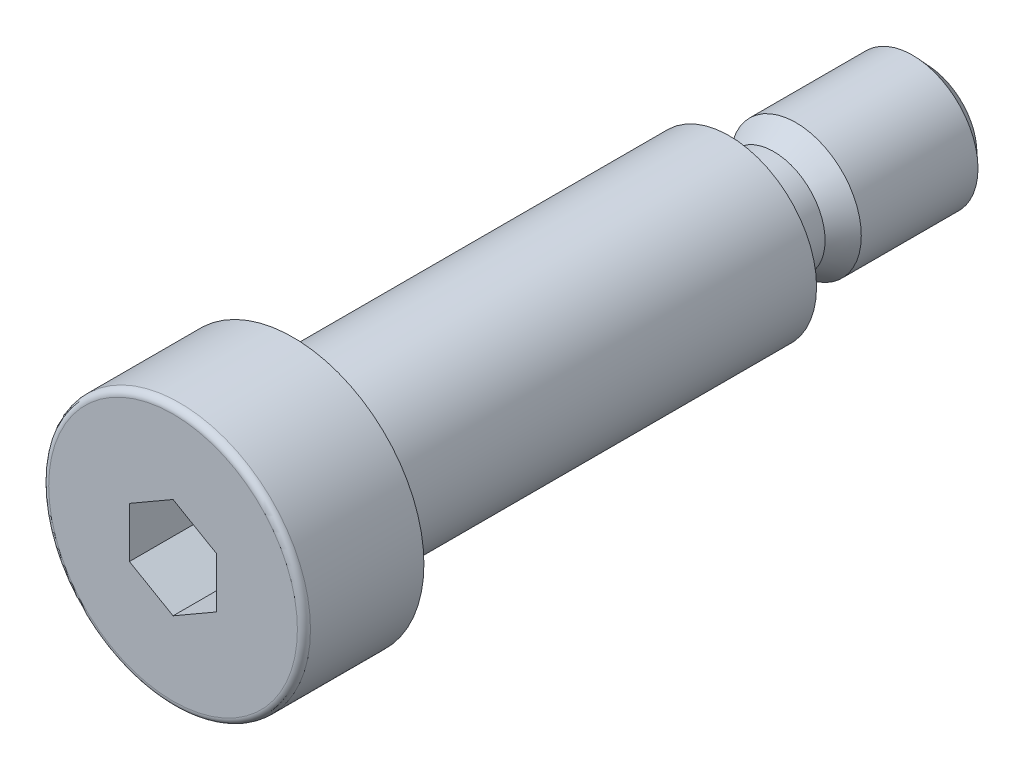
from build123d import *

# Parameters (mm, degrees)
SZKIC1_W                   = 4.7
SZKIC1_H                   = 4.08
WYTNIJ_WYCI_GNI_CIE1_DEPTH = 6.6
ZAOKR_GLENIE1_R            = 0.6


with BuildPart() as part:
    # Szkic1 → Obrót1 (revolve)
    with BuildSketch(Plane(origin=(0, 0, 0), x_dir=(1, 0, 0), z_dir=(0, 1, 0)), mode=Mode.PRIVATE) as obr_t1_sk:
        Polygon((0, -31), (0, -20), (-8, -20), (-12, -20), (-12, -31), align=None)
        Polygon((0, -20), (0, 20), (-4.7, 20), (-8, 20), (-8, -20), align=None)
        with Locations((-2.35, 22.04)):
            Rectangle(SZKIC1_W, SZKIC1_H)
        Polygon((-4.7, 24.08), (0, 24.08), (0, 38), (-4.7, 38), (-6, 36.8), (-6, 26.1), align=None)
    revolve(obr_t1_sk.sketch.rotate(Axis((0, 0, 31), (0, 0, -1)), 180), axis=Axis((0, 0, 31), (0, 0, -1)))

    # Szkic2 → Wytnij-wyciągnięcie1 (cut)
    with BuildSketch(Plane.XY.offset(31)):
        Polygon((4, 2.309401077), (0, 4.618802154), (-4, 2.309401077), (-4, -2.309401077), (0, -4.618802154), (4, -2.309401077), align=None)
    extrude(amount=-WYTNIJ_WYCI_GNI_CIE1_DEPTH, mode=Mode.SUBTRACT)

    # Zaokrąglenie1
    zaokr_glenie1_edges = [part.edges().sort_by_distance(p)[0] for p in [
        (-12, 0, 31),
    ]]
    fillet(zaokr_glenie1_edges, radius=ZAOKR_GLENIE1_R)


solid = part.part
